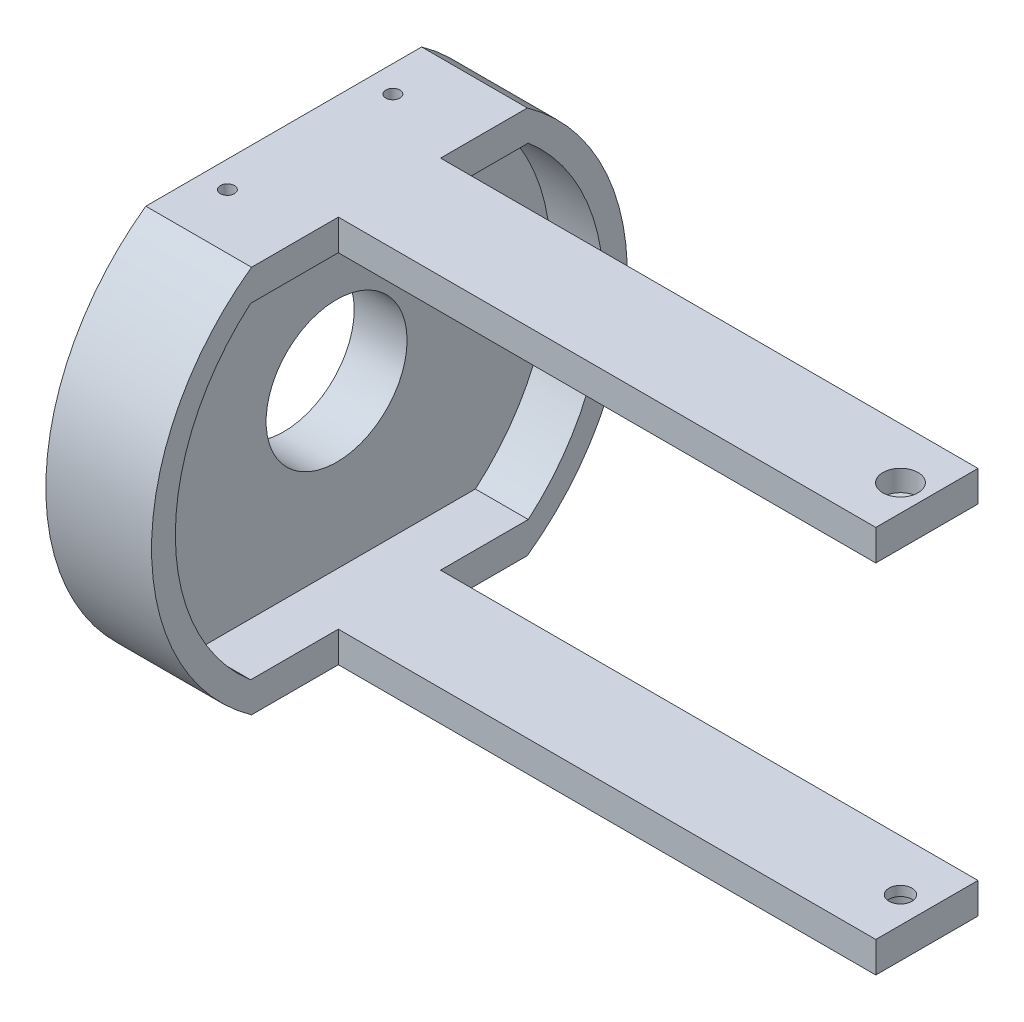
from build123d import *

# Parameters (mm, degrees)
SKETCH_1_R          = 4
EXTRUDE_1_DEPTH     = 3
EXTRUDE_2_DEPTH     = 3
SKETCH_3_W          = 36.5
SKETCH_3_H          = 5.8
SKETCH_3_R          = 0.65
EXTRUDE_3_DEPTH     = 1.75
SKETCH_3_4_R        = 1
CUT_EXTRUDE_1_DEPTH = 1.2
EXTRUDE_START       = -22
SKETCH_3_5_W        = 36.5
SKETCH_3_5_H        = 5.8
SKETCH_3_5_R        = 0.65
EXTRUDE_4_DEPTH     = 1.75
CUT_EXTRUDE_START   = -20.8
SKETCH_3_6_R        = 1
CUT_EXTRUDE_2_DEPTH = 1.2
SKETCH_5_R          = 0.4
CUT_EXTRUDE_3_DEPTH = 2


with BuildPart() as part:
    # 草图1 → 凸台-拉伸1 (new body)
    with BuildSketch(Plane(origin=(0, 0, 0), x_dir=(0, 0, -1), z_dir=(1, 0, 0))):
        with BuildLine():
            ThreePointArc((-13.5, 3.1e-08), (-11.998004256, -6.188529216), (-7.826237921, -11))
            Line((-7.826237921, -11), (7.826237921, -11))
            ThreePointArc((7.826237921, -11), (11.998004249, -6.18852923), (13.5, 0))
            ThreePointArc((13.5, 0), (11.998004249, 6.18852923), (7.826237921, 11))
            Line((7.826237921, 11), (-7.826237921, 11))
            ThreePointArc((-7.826237921, 11), (-11.998004242, 6.188529244), (-13.5, 3.1e-08))
        make_face()
        Circle(SKETCH_1_R, mode=Mode.SUBTRACT)
    extrude(amount=EXTRUDE_1_DEPTH)

    # 草图2 → 凸台-拉伸2 (add)
    with BuildSketch(Plane(origin=(3, 0, 0), x_dir=(0, 0, -1), z_dir=(1, 0, 0))):
        with BuildLine():
            ThreePointArc((-5.159699604, 11), (-6.577220881, 10.215804691), (-7.877816956, 9.25))
            Line((-7.877816956, 9.25), (7.877816956, 9.25))
            ThreePointArc((7.877816956, 9.25), (6.577220881, 10.215804691), (5.159699604, 11))
            Line((5.159699604, 11), (-5.159699604, 11))
        make_face()
        with BuildLine():
            Line((-9.83298022, 9.25), (-7.877816956, 9.25))
            ThreePointArc((-7.877816956, 9.25), (-6.577220881, 10.215804691), (-5.159699604, 11))
            Line((-5.159699604, 11), (-7.826237921, 11))
            ThreePointArc((-7.826237921, 11), (-8.87285869, 10.174594767), (-9.83298022, 9.25))
        make_face()
        with BuildLine():
            Line((-12.15, 5.884513574), (-12.15, 2.4e-08))
            ThreePointArc((-12.15, 2.4e-08), (-11.030366626, 5.09445896), (-7.877816956, 9.25))
            Line((-7.877816956, 9.25), (-9.83298022, 9.25))
            ThreePointArc((-9.83298022, 9.25), (-11.119553928, 7.65542425), (-12.15, 5.884513574))
        make_face()
        with BuildLine():
            ThreePointArc((-12.15, 5.884513574), (-13.5, 0), (-12.15, -5.884513574))
            Line((-12.15, -5.884513574), (-12.15, 2.4e-08))
            Line((-12.15, 2.4e-08), (-12.15, 5.884513574))
        make_face()
        with BuildLine():
            ThreePointArc((-12.15, -5.884513574), (-11.119553928, -7.65542425), (-9.83298022, -9.25))
            Line((-9.83298022, -9.25), (-7.877816956, -9.25))
            ThreePointArc((-7.877816956, -9.25), (-11.030366636, -5.094458939), (-12.15, 2.4e-08))
            Line((-12.15, 2.4e-08), (-12.15, -5.884513574))
        make_face()
        with BuildLine():
            Line((-7.877816956, -9.25), (-9.83298022, -9.25))
            ThreePointArc((-9.83298022, -9.25), (-8.87285869, -10.174594767), (-7.826237921, -11))
            Line((-7.826237921, -11), (-5.159699604, -11))
            ThreePointArc((-5.159699604, -11), (-6.577220881, -10.215804691), (-7.877816956, -9.25))
        make_face()
        with BuildLine():
            Line((7.877816956, -9.25), (-7.877816956, -9.25))
            ThreePointArc((-7.877816956, -9.25), (-6.577220881, -10.215804691), (-5.159699604, -11))
            Line((-5.159699604, -11), (5.159699604, -11))
            ThreePointArc((5.159699604, -11), (6.577220881, -10.215804691), (7.877816956, -9.25))
        make_face()
        with BuildLine():
            Line((9.83298022, -9.25), (7.877816956, -9.25))
            ThreePointArc((7.877816956, -9.25), (6.577220881, -10.215804691), (5.159699604, -11))
            Line((5.159699604, -11), (7.826237921, -11))
            ThreePointArc((7.826237921, -11), (8.87285869, -10.174594767), (9.83298022, -9.25))
        make_face()
        with BuildLine():
            ThreePointArc((12.15, 0), (11.030366631, -5.09445895), (7.877816956, -9.25))
            Line((7.877816956, -9.25), (9.83298022, -9.25))
            ThreePointArc((9.83298022, -9.25), (11.119553928, -7.65542425), (12.15, -5.884513574))
            Line((12.15, -5.884513574), (12.15, 0))
        make_face()
        with BuildLine():
            Line((12.15, 5.884513574), (12.15, 0))
            Line((12.15, 0), (12.15, -5.884513574))
            ThreePointArc((12.15, -5.884513574), (13.5, 0), (12.15, 5.884513574))
        make_face()
        with BuildLine():
            ThreePointArc((7.877816956, 9.25), (11.030366631, 5.09445895), (12.15, 0))
            Line((12.15, 0), (12.15, 5.884513574))
            ThreePointArc((12.15, 5.884513574), (11.119553928, 7.65542425), (9.83298022, 9.25))
            Line((9.83298022, 9.25), (7.877816956, 9.25))
        make_face()
        with BuildLine():
            ThreePointArc((5.159699604, 11), (6.577220881, 10.215804691), (7.877816956, 9.25))
            Line((7.877816956, 9.25), (9.83298022, 9.25))
            ThreePointArc((9.83298022, 9.25), (8.87285869, 10.174594767), (7.826237921, 11))
            Line((7.826237921, 11), (5.159699604, 11))
        make_face()
    extrude(amount=EXTRUDE_2_DEPTH)

    # 草图3 → 凸台-拉伸3 (add)
    with BuildSketch(Plane(origin=(0, 11, 0), x_dir=(1, 0, 0), z_dir=(0, 1, 0))):
        with Locations((18.25, 0)):
            Rectangle(SKETCH_3_W, SKETCH_3_H)
        with Locations(Location((35, 0, 0), (0, 0, 270))):
            Circle(SKETCH_3_R, mode=Mode.SUBTRACT)
    extrude(amount=-EXTRUDE_3_DEPTH)

    # 草图3<4> → 切除-拉伸1 (cut)
    with BuildSketch(Plane(origin=(0, 11, 0), x_dir=(1, 0, 0), z_dir=(0, 1, 0))):
        with Locations(Location((35, 0, 0), (0, 0, 270))):
            Circle(SKETCH_3_4_R)
    extrude(amount=-CUT_EXTRUDE_1_DEPTH, mode=Mode.SUBTRACT)

    # 草图3<5> → 凸台-拉伸4 (add)
    with BuildSketch(Plane(origin=(0, 11, 0), x_dir=(1, 0, 0), z_dir=(0, 1, 0)).offset(EXTRUDE_START)):
        with Locations((18.25, 0)):
            Rectangle(SKETCH_3_5_W, SKETCH_3_5_H)
        with Locations(Location((35, 0, 0), (0, 0, 270))):
            Circle(SKETCH_3_5_R, mode=Mode.SUBTRACT)
    extrude(amount=EXTRUDE_4_DEPTH)

    # 草图3<6> → 切除-拉伸2 (cut)
    with BuildSketch(Plane(origin=(0, 11, 0), x_dir=(1, 0, 0), z_dir=(0, 1, 0)).offset(CUT_EXTRUDE_START)):
        with Locations(Location((35, 0, 0), (0, 0, 270))):
            Circle(SKETCH_3_6_R)
    extrude(amount=-CUT_EXTRUDE_2_DEPTH, mode=Mode.SUBTRACT)

    # 草图5 → 切除-拉伸3 (cut)
    with BuildSketch(Plane(origin=(0, 11, 0), x_dir=(1, 0, 0), z_dir=(0, 1, 0))):
        with Locations(Location((1.5, -4.695742753, 0), (0, 0, 270))):
            Circle(SKETCH_5_R)
        with Locations(Location((1.5, 4.695742753, 0), (0, 0, 270))):
            Circle(SKETCH_5_R)
    extrude(amount=-CUT_EXTRUDE_3_DEPTH, mode=Mode.SUBTRACT)


solid = part.part
